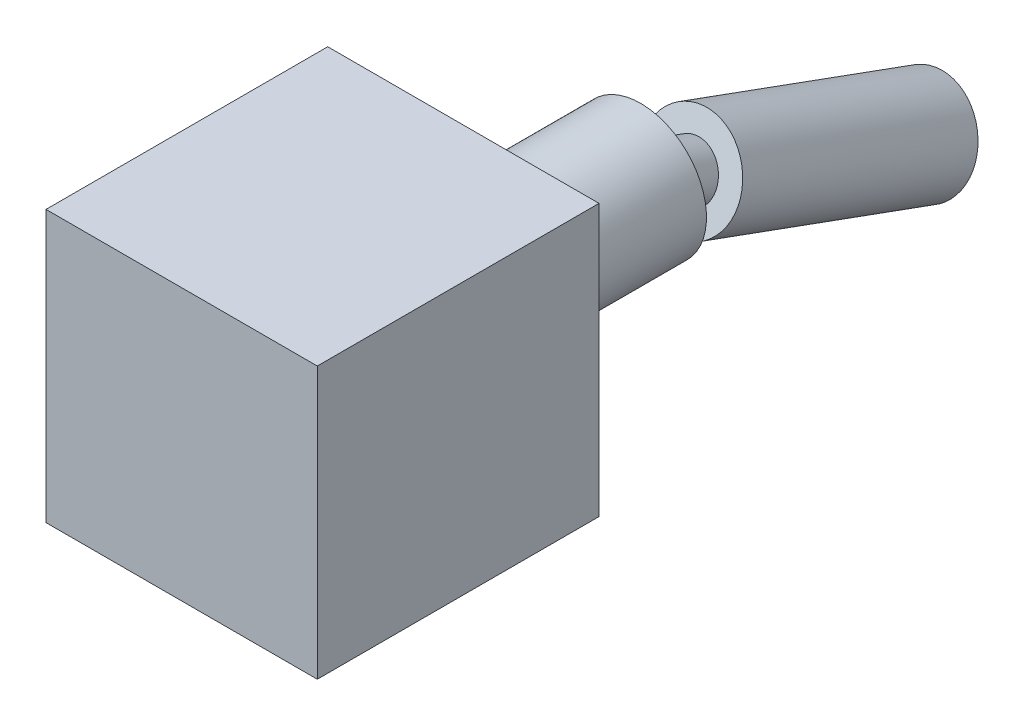
from build123d import *

# Parameters (mm, degrees)
SKETCH1_W           = 13
SKETCH1_H           = 13.5
BOSS_EXTRUDE1_DEPTH = 13
SKETCH2_R           = 3.15
BOSS_EXTRUDE2_DEPTH = 8.5
SKETCH3_R           = 4
BOSS_EXTRUDE3_DEPTH = 1
CHAMFER1_SIZE       = 0.2


with BuildPart() as part:
    # Sketch1 → Boss-Extrude1 (new body)
    with BuildSketch(Plane(origin=(0, 0, 0), x_dir=(1, 0, 0), z_dir=(0, 1, 0))):
        Rectangle(SKETCH1_W, SKETCH1_H)
    extrude(amount=BOSS_EXTRUDE1_DEPTH)

    # Sketch2 → Boss-Extrude2 (add)
    with BuildSketch(Plane(origin=(0, 0, -6.75), x_dir=(-1, 0, 0), z_dir=(0, 0, -1))):
        with Locations(Location((0, 6.5, 0), (0, 0, 180))):
            Circle(SKETCH2_R)
    extrude(amount=BOSS_EXTRUDE2_DEPTH)

    # Sketch3 → Boss-Extrude3 (add)
    with BuildSketch(Plane(origin=(0, 0, -6.75), x_dir=(-1, 0, 0), z_dir=(0, 0, -1))):
        with Locations(Location((0, 6.5, 0), (0, 0, 180))):
            Circle(SKETCH3_R)
    extrude(amount=BOSS_EXTRUDE3_DEPTH)

    # Sketch4 → Revolve1 (revolve)
    with BuildSketch(Plane(origin=(0, 0, 0), x_dir=(0, 0, -1), z_dir=(1, 0, 0))):
        with BuildLine():
            Line((14.310307379, 6.842020143), (13.865681193, 5.620419736))
            Line((13.865681193, 5.620419736), (17.154605366, 4.423349235))
            Line((17.154605366, 4.423349235), (16.778383208, 3.389687352))
            Line((16.778383208, 3.389687352), (28.242633182, -0.782958397))
            Line((28.242633182, -0.782958397), (28.635956346, 0.297688117))
            ThreePointArc((28.635956346, 0.297688117), (29.283711619, 0.637305625), (29.693868496, 1.2428618))
            Line((29.693868496, 1.2428618), (14.310307379, 6.842020143))
        make_face()
    revolve(axis=Axis((0, 6.5, -15.25), (0, -0.34202014332566943, -0.9396926207859081)))

    # Chamfer1
    chamfer1_edges = [part.edges().sort_by_distance(p)[0] for p in [
        (0, 3.727566183, -29.88432987),
    ]]
    chamfer(chamfer1_edges, length=CHAMFER1_SIZE)


solid = part.part
